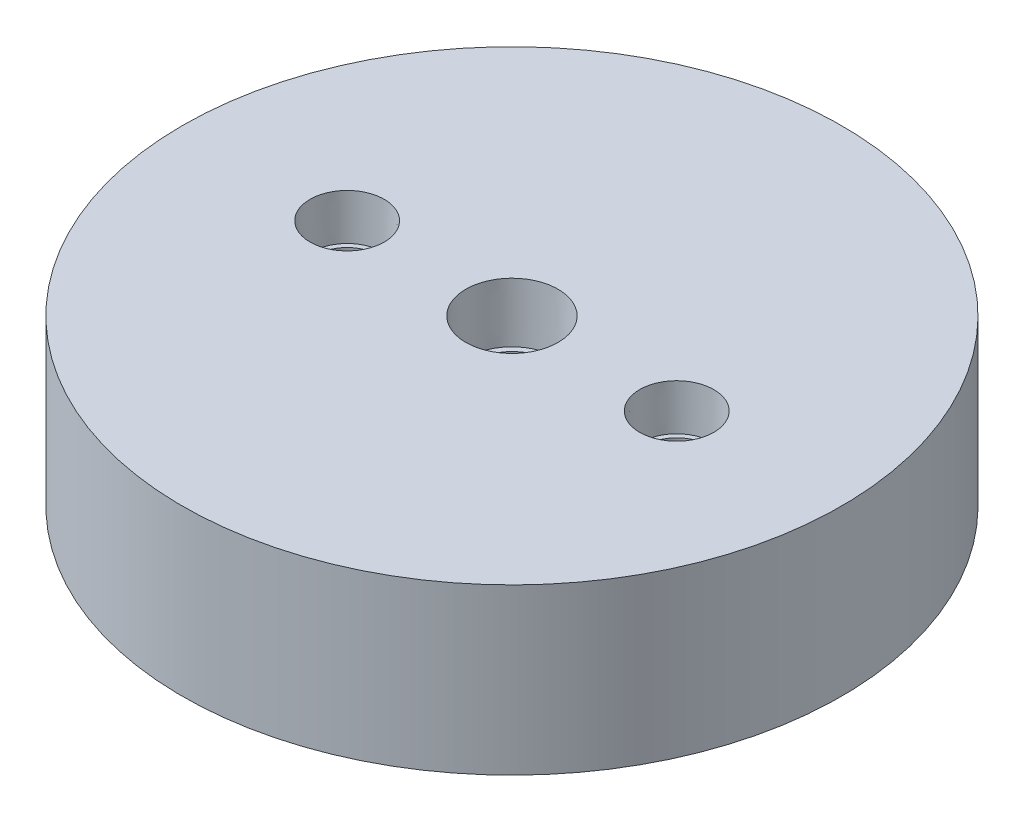
from build123d import *

# Parameters (mm, degrees)
F_3_8_NPT_TAPPED_HOLE1_AT_2_COUNT = 2
F_3_8_NPT_TAPPED_HOLE1_AT_2_PITCH = 76.2


with BuildPart() as part:
    # Sketch1 → Revolve1 (revolve)
    with BuildSketch(Plane.XY):
        Polygon((0, 0), (-76.2, 0), (-76.2, -38.1), (-60.96, -38.1), (-60.96, -32.258), (-55.7149, -32.258), (-51.6509, -32.258), (-32.163982831, -32.258), (-30.364664072, -32.258), (-28.575, -32.258), (-28.575, -27.178), (-28.0924, -27.178), (-24.0284, -27.178), (-22.225, -27.178), (0, -15.85722), align=None)
    revolve(axis=Axis((0, 0, 0), (0, -1, 0)))

    # Sketch3 → 1/2 NPT Tapped Hole1 (revolve, cut)
    with BuildSketch(Plane(origin=(0, 0, 0), x_dir=(0, 0, 1), z_dir=(1, 0, 0))):
        Polygon((0, 0), (0, 38.1), (8.9281, 38.1), (8.9281, 13.462), (10.261665792, 13.462), (10.6647361, 0), align=None)
    revolve(axis=Axis((0, 6.35, 0), (0, -1, 0)), mode=Mode.SUBTRACT)

    # Sketch5 → 3/8 NPT Tapped Hole1 (revolve, cut)
    with BuildSketch(Plane(origin=(-38.1, 0, 0), x_dir=(0, 0, 1), z_dir=(1, 0, 0))):
        Polygon((0, 0), (0, 38.1), (7.1374, 38.1), (7.1374, 10.414), (8.263205494, 10.414), (8.5750146, 0), align=None)
    f_3_8_npt_tapped_hole1 = revolve(axis=Axis((-38.1, 6.35, 0), (0, -1, 0)), mode=Mode.SUBTRACT)

    # 3/8 NPT Tapped Hole1 at 2: 3/8 NPT Tapped Hole1 ×2
    with Locations(*[(i * F_3_8_NPT_TAPPED_HOLE1_AT_2_PITCH, 0, 0) for i in range(1, F_3_8_NPT_TAPPED_HOLE1_AT_2_COUNT)]):
        add(f_3_8_npt_tapped_hole1, mode=Mode.SUBTRACT)


solid = part.part
